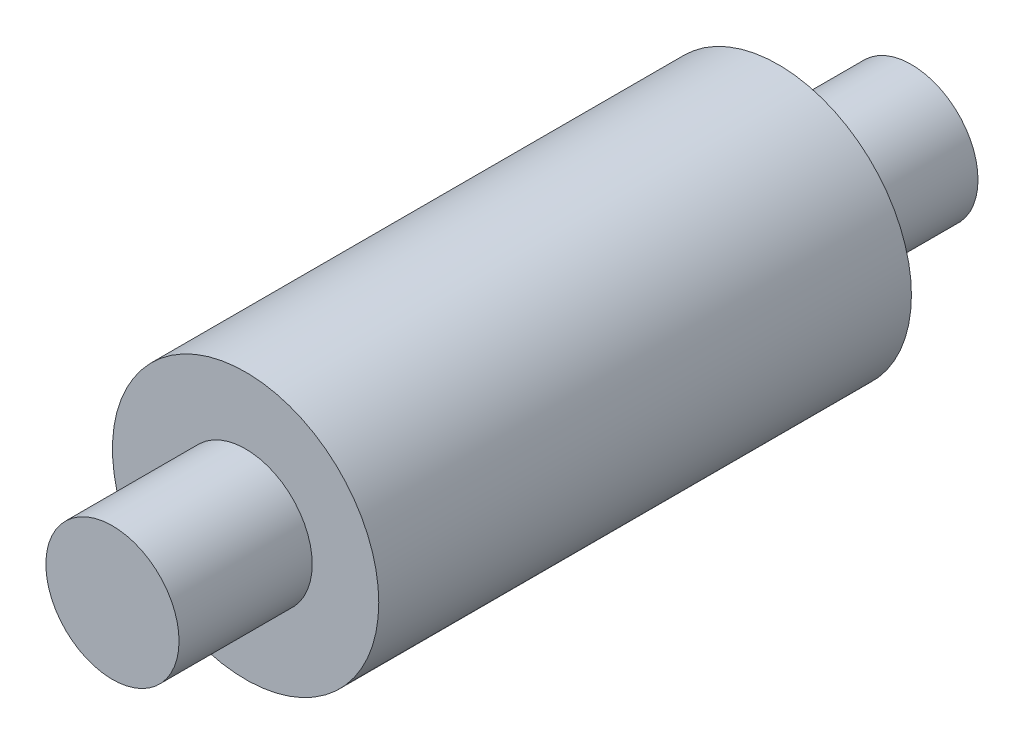
from build123d import *

# Parameters (mm, degrees)
SKETCH1_R           = 5
BOSS_EXTRUDE1_DEPTH = 10
SKETCH2_R           = 2.5
BOSS_EXTRUDE2_DEPTH = 5


with BuildPart() as part:
    # Sketch1 → Boss-Extrude1 (new, symmetric)
    with BuildSketch(Plane.XY):
        Circle(SKETCH1_R)
    extrude(amount=BOSS_EXTRUDE1_DEPTH, both=True)

    # Sketch2 → Boss-Extrude2 (add)
    with BuildSketch(Plane.XY.offset(10)):
        Circle(SKETCH2_R)
    boss_extrude2 = extrude(amount=BOSS_EXTRUDE2_DEPTH)

    # Mirror1: Boss-Extrude2 across plane
    add(boss_extrude2.mirror(Plane.XY))


solid = part.part
